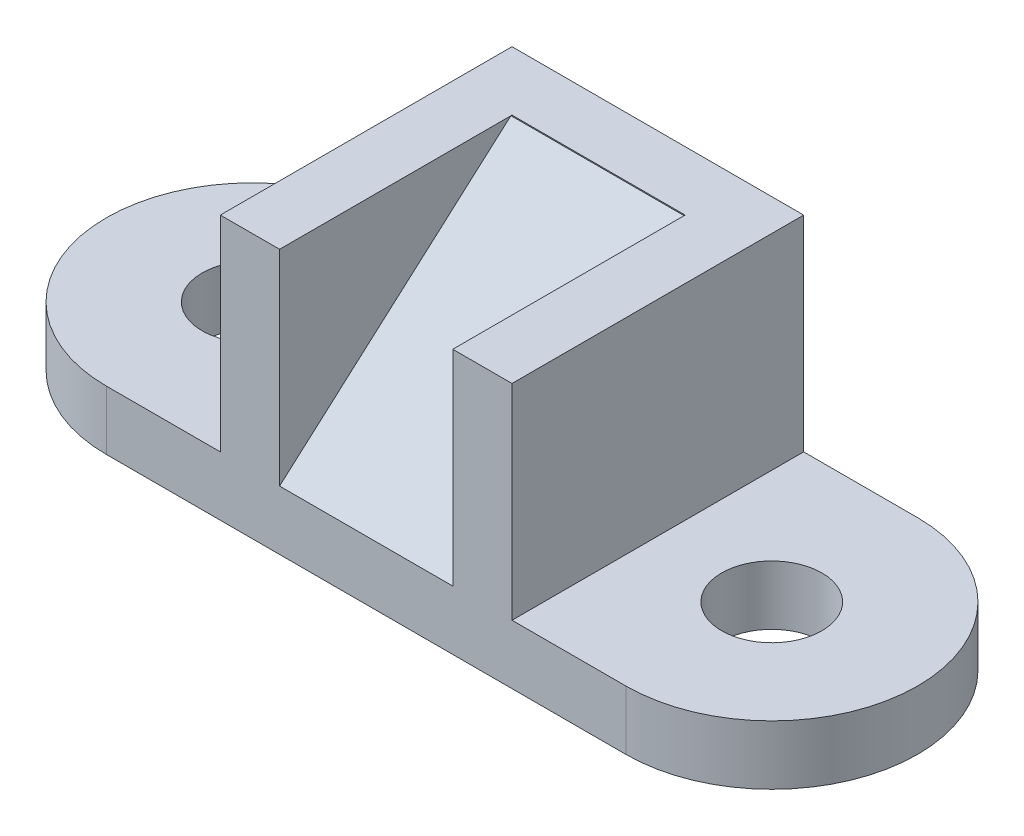
from build123d import *

# Parameters (mm, degrees)
SKETCH2_R           = 11
BOSS_EXTRUDE1_DEPTH = 58
CUT_EXTRUDE1_START  = -45
CUT_EXTRUDE1_DEPTH  = 45
SKETCH4_W           = 38
SKETCH4_H           = 51
CUT_EXTRUDE7_DEPTH  = 45
BOSS_EXTRUDE2_DEPTH = 45


with BuildPart() as part:
    # Sketch2 → Boss-Extrude1 (new body)
    with BuildSketch(Plane(origin=(0, 0, 0), x_dir=(1, 0, 0), z_dir=(0, 1, 0))):
        with BuildLine():
            Line((57, 32), (-57, 32))
            ThreePointArc((-57, 32), (-89, 0), (-57, -32))
            Line((-57, -32), (57, -32))
            ThreePointArc((57, -32), (89, 0), (57, 32))
        make_face()
        with Locations(Location((-57, 0, 0), (0, 0, 90))):
            Circle(SKETCH2_R, mode=Mode.SUBTRACT)
        with Locations(Location((57, 0, 0), (0, 0, 90))):
            Circle(SKETCH2_R, mode=Mode.SUBTRACT)
    extrude(amount=BOSS_EXTRUDE1_DEPTH)

    # Sketch3 → Cut-Extrude1 (cut)
    with BuildSketch(Plane(origin=(0, 58, 0), x_dir=(1, 0, 0), z_dir=(0, 1, 0)).offset(CUT_EXTRUDE1_START)):
        with BuildLine():
            Line((-32, 32), (-32, -32))
            Line((-32, -32), (-57, -32))
            ThreePointArc((-57, -32), (-89, 0), (-57, 32))
            Line((-57, 32), (-32, 32))
        make_face()
        with BuildLine():
            Line((32, 32), (32, -32))
            Line((32, -32), (57, -32))
            ThreePointArc((57, -32), (89, 0), (57, 32))
            Line((57, 32), (32, 32))
        make_face()
    extrude(amount=CUT_EXTRUDE1_DEPTH, mode=Mode.SUBTRACT)

    # Sketch4 → Cut-Extrude7 (cut)
    with BuildSketch(Plane(origin=(0, 58, 0), x_dir=(1, 0, 0), z_dir=(0, 1, 0))):
        with Locations((0, -6.5)):
            Rectangle(SKETCH4_W, SKETCH4_H)
    extrude(amount=-CUT_EXTRUDE7_DEPTH, mode=Mode.SUBTRACT)

    # Sketch6 → Boss-Extrude2 (add)
    with BuildSketch(Plane(origin=(-19, 0, 0), x_dir=(0, 0, -1), z_dir=(1, 0, 0))):
        Polygon((18.765593609, 58), (-32, 13), (18.765593609, 13), align=None)
    extrude(amount=BOSS_EXTRUDE2_DEPTH)


solid = part.part
